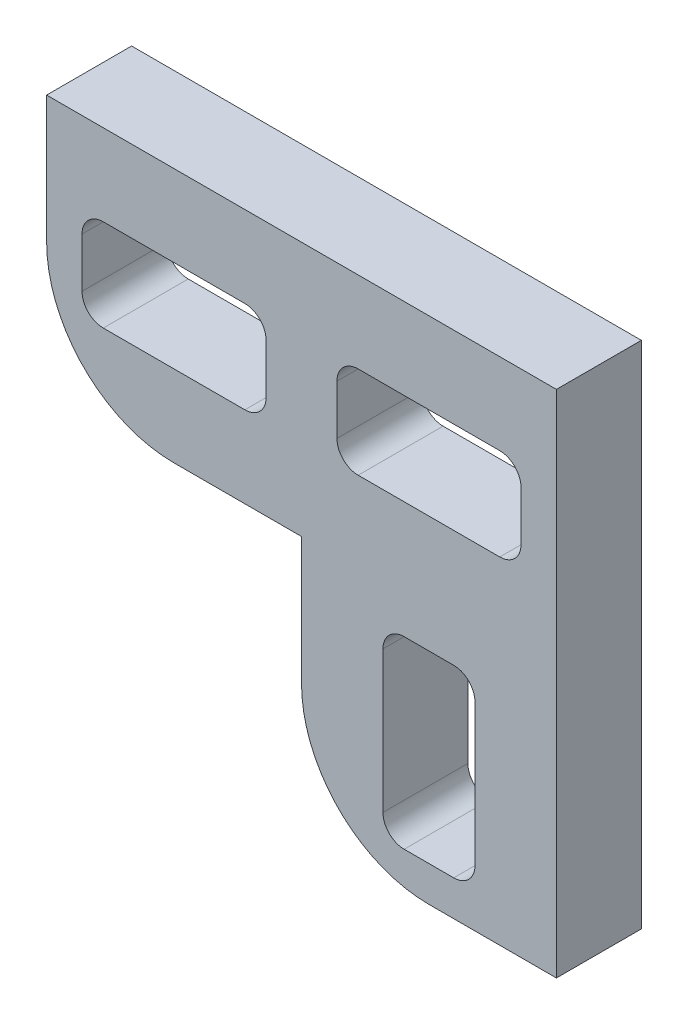
from build123d import *

# Parameters (mm, degrees)
SALIENTE_EXTRUIR1_DEPTH = 3


with BuildPart() as part:
    # Model → Saliente-Extruir1 (new body)
    with BuildSketch(Plane.XY):
        with BuildLine():
            Line((149.34213351, 211.823953209), (158.34213351, 211.823953209))
            Line((158.34213351, 211.823953209), (162.84213351, 211.823953209))
            Line((162.84213351, 211.823953209), (162.84213351, 198.323953209))
            Line((162.84213351, 198.323953209), (162.84213351, 193.823953209))
            Line((162.84213351, 193.823953209), (158.34213351, 193.823953209))
            ThreePointArc((158.34213351, 193.823953209), (155.160152994, 195.141972694), (153.84213351, 198.323953209))
            Line((153.84213351, 198.323953209), (153.84213351, 202.823953209))
            Line((153.84213351, 202.823953209), (149.34213351, 202.823953209))
            ThreePointArc((149.34213351, 202.823953209), (146.160152994, 204.141972694), (144.84213351, 207.323953209))
            Line((144.84213351, 207.323953209), (144.84213351, 211.823953209))
            Line((144.84213351, 211.823953209), (149.34213351, 211.823953209))
        make_face()
        with BuildLine():
            Line((156.71713351, 195.823953209), (156.71713351, 200.823953209))
            ThreePointArc((156.71713351, 200.823953209), (156.936803424, 201.354283295), (157.46713351, 201.573953209))
            Line((157.46713351, 201.573953209), (159.21713351, 201.573953209))
            ThreePointArc((159.21713351, 201.573953209), (159.747463595, 201.354283295), (159.96713351, 200.823953209))
            Line((159.96713351, 200.823953209), (159.96713351, 195.823953209))
            ThreePointArc((159.96713351, 195.823953209), (159.747463595, 195.293623123), (159.21713351, 195.073953209))
            Line((159.21713351, 195.073953209), (157.46713351, 195.073953209))
            ThreePointArc((157.46713351, 195.073953209), (156.936803424, 195.293623123), (156.71713351, 195.823953209))
        make_face(mode=Mode.SUBTRACT)
        with BuildLine():
            Line((151.84213351, 205.698953209), (146.84213351, 205.698953209))
            ThreePointArc((146.84213351, 205.698953209), (146.311803424, 205.918623123), (146.09213351, 206.448953209))
            Line((146.09213351, 206.448953209), (146.09213351, 208.198953209))
            ThreePointArc((146.09213351, 208.198953209), (146.311803424, 208.729283295), (146.84213351, 208.948953209))
            Line((146.84213351, 208.948953209), (151.84213351, 208.948953209))
            ThreePointArc((151.84213351, 208.948953209), (152.372463595, 208.729283295), (152.59213351, 208.198953209))
            Line((152.59213351, 208.198953209), (152.59213351, 206.448953209))
            ThreePointArc((152.59213351, 206.448953209), (152.372463595, 205.918623123), (151.84213351, 205.698953209))
        make_face(mode=Mode.SUBTRACT)
        with BuildLine():
            Line((160.84213351, 205.698953209), (155.84213351, 205.698953209))
            ThreePointArc((155.84213351, 205.698953209), (155.311803424, 205.918623123), (155.09213351, 206.448953209))
            Line((155.09213351, 206.448953209), (155.09213351, 208.198953209))
            ThreePointArc((155.09213351, 208.198953209), (155.311803424, 208.729283295), (155.84213351, 208.948953209))
            Line((155.84213351, 208.948953209), (160.84213351, 208.948953209))
            ThreePointArc((160.84213351, 208.948953209), (161.372463595, 208.729283295), (161.59213351, 208.198953209))
            Line((161.59213351, 208.198953209), (161.59213351, 206.448953209))
            ThreePointArc((161.59213351, 206.448953209), (161.372463595, 205.918623123), (160.84213351, 205.698953209))
        make_face(mode=Mode.SUBTRACT)
    extrude(amount=SALIENTE_EXTRUIR1_DEPTH)


solid = part.part
